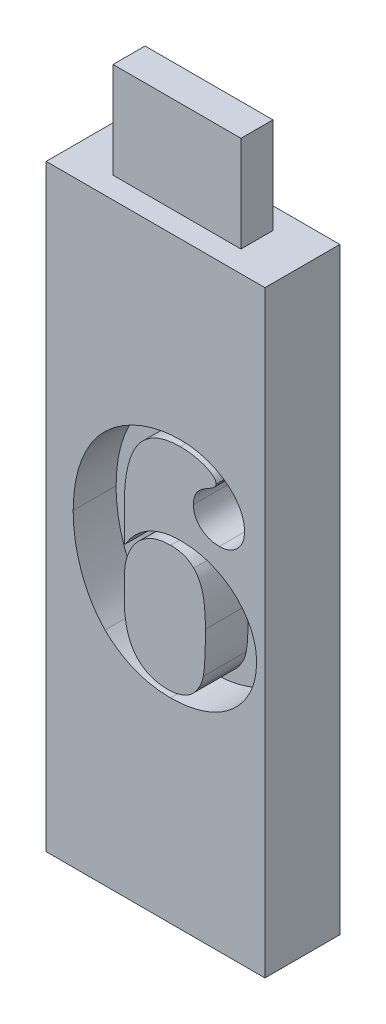
from build123d import *

# Parameters (mm, degrees)
SKETCH1_W           = 17.38
SKETCH1_H           = 47.498
BOSS_EXTRUDE1_DEPTH = 5.95
CUT_EXTRUDE1_DEPTH  = 3.41
SKETCH3_W           = 10.16
SKETCH3_H           = 2.54
BOSS_EXTRUDE2_DEPTH = 7.62


with BuildPart() as part:
    # Sketch1 → Boss-Extrude1 (new body)
    with BuildSketch(Plane.XY):
        Rectangle(SKETCH1_W, SKETCH1_H)
    extrude(amount=BOSS_EXTRUDE1_DEPTH)

    # Sketch2 → Cut-Extrude1 (cut)
    with BuildSketch(Plane.XY.offset(5.95)):
        with BuildLine():
            Line((-2.483570852, 3.233513783), (-2.483570852, 0.531761662))
            Line((-2.483570852, 0.531761662), (-2.431327027, 0.531761662))
            add(Edge.make_bspline(
                [(-2.431327027, 0.531761662), (-2.301633443, 0.728004463), (-2.04890766, 1.110410549), (-1.59841556, 1.61627183), (-1.104273504, 2.044303347), (-0.565213823, 2.396543519), (0.020062663, 2.666484477), (0.647167649, 2.860520396), (1.319499928, 2.979575642), (1.782504398, 2.992018255), (2.020593251, 2.998416568)],
                knots=[0, 0, 0, 0, 1.056220461, 2.058190816, 3.033330861, 3.987046614, 4.942579704, 5.920488651, 6.930661574, 8, 8, 8, 8], degree=3))
            add(Edge.make_bspline(
                [(2.020593251, 2.998416568), (2.291024879, 2.989726752), (2.822688252, 2.972642741), (3.603097789, 2.839948645), (4.346430935, 2.61354988), (5.049160763, 2.305239746), (5.70119483, 1.921473283), (6.285965544, 1.464848311), (6.799589537, 0.940462699), (7.234824577, 0.355514148), (7.587839118, -0.277068181), (7.838772014, -0.950147499), (7.999881544, -1.653634968), (8.016504347, -2.135531766), (8.024901487, -2.378965762)],
                knots=[0, 0, 0, 0, 1.085565472, 2.134200812, 3.167617413, 4.198689485, 5.20867526, 6.197881964, 7.169234309, 8.147254864, 9.117566385, 10.067570574, 11.023817926, 12, 12, 12, 12], degree=3))
            add(Edge.make_bspline(
                [(8.024901487, -2.378965762), (8.021696861, -2.513392762), (8.01533223, -2.780375001), (7.974678924, -3.176124846), (7.902094334, -3.56223173), (7.806223843, -3.940876557), (7.678303321, -4.309483663), (7.525248707, -4.670692294), (7.340555615, -5.020996539), (7.133591771, -5.364218641), (6.897907386, -5.690377589), (6.644318497, -6.002506927), (6.366887623, -6.292467788), (6.071535257, -6.568600946), (5.748554094, -6.819327185), (5.41051496, -7.06112093), (5.046666519, -7.275695629), (4.537288266, -7.540917281), (3.863752304, -7.819178984), (3.008909006, -8.053317379), (2.112657358, -8.199141153), (1.499959436, -8.217306216), (1.188423744, -8.226542522)],
                knots=[0, 0, 0, 0, 0.804288942, 1.59737897, 2.376839251, 3.152988498, 3.931986793, 4.708849282, 5.497738221, 6.299268016, 7.104692352, 7.903210753, 8.703357407, 9.50385007, 10.319761299, 11.147700359, 11.988780022, 12.844223646, 14.582806956, 16.3359984, 18.136981967, 20, 20, 20, 20], degree=3))
            add(Edge.make_bspline(
                [(1.188423744, -8.226542522), (0.933120462, -8.219963195), (0.430587576, -8.207012606), (-0.306955805, -8.108572416), (-1.01240185, -7.945190052), (-1.683445678, -7.712294765), (-2.320522841, -7.416084718), (-2.923453171, -7.059116449), (-3.495421502, -6.646350498), (-3.840157488, -6.324706605), (-4.0135686, -6.162911413)],
                knots=[0, 0, 0, 0, 1.066279502, 2.098839125, 3.102153465, 4.086517057, 5.060622849, 6.032022188, 7.010056287, 8, 8, 8, 8], degree=3))
            add(Edge.make_bspline(
                [(-4.0135686, -6.162911413), (-4.144115002, -6.023187792), (-4.406717191, -5.74212506), (-4.759576912, -5.278557214), (-5.090362905, -4.785509921), (-5.387843956, -4.256131974), (-5.650175286, -3.695741555), (-5.887990361, -3.114311813), (-6.083740456, -2.505717976), (-6.252881159, -1.877450318), (-6.382639032, -1.227876364), (-6.475225118, -0.563754728), (-6.533102612, 0.112780916), (-6.540126826, 0.567720377), (-6.543662438, 0.796712491)],
                knots=[0, 0, 0, 0, 0.906810192, 1.82410497, 2.760456108, 3.722425217, 4.701924771, 5.694917275, 6.700944844, 7.733173074, 8.780727414, 9.841631564, 10.913593138, 12, 12, 12, 12], degree=3))
            add(Edge.make_bspline(
                [(-6.543662438, 0.796712491), (-6.535275919, 1.125414253), (-6.51873622, 1.773672285), (-6.402858902, 2.72716023), (-6.204095817, 3.642456725), (-5.928580775, 4.517650427), (-5.575835213, 5.346550679), (-5.143134486, 6.120612191), (-4.637372255, 6.841209129), (-4.236609892, 7.26700551), (-4.035958811, 7.48019046)],
                knots=[0, 0, 0, 0, 1.076732046, 2.123506097, 3.140990736, 4.14108443, 5.125083853, 6.086480381, 7.041951503, 8, 8, 8, 8], degree=3))
            add(Edge.make_bspline(
                [(-4.035958811, 7.48019046), (-3.835748195, 7.667523696), (-3.436434164, 8.041154179), (-2.767828463, 8.522710055), (-2.05279501, 8.94162773), (-1.29378104, 9.295899885), (-0.501963955, 9.573561744), (0.305869221, 9.776417565), (1.126138704, 9.900161498), (1.676858248, 9.916333687), (1.953422618, 9.924455156)],
                knots=[0, 0, 0, 0, 0.991626942, 1.977770001, 2.974698163, 3.98792387, 5.004674858, 6.007149241, 6.999215628, 8, 8, 8, 8], degree=3))
            add(Edge.make_bspline(
                [(1.953422618, 9.924455156), (2.183928864, 9.919629706), (2.637132028, 9.910142288), (3.299318367, 9.808425453), (3.931494772, 9.6533518), (4.527218995, 9.433851095), (5.077965419, 9.157930959), (5.578927779, 8.838848945), (6.016887161, 8.465425006), (6.387526638, 8.048566407), (6.694626795, 7.60421693), (6.908945915, 7.128685255), (7.048312481, 6.634790896), (7.062479966, 6.295671606), (7.06958582, 6.125582698)],
                knots=[0, 0, 0, 0, 1.176649862, 2.313435961, 3.413818245, 4.497431994, 5.548876995, 6.555291509, 7.524342622, 8.478423796, 9.398398398, 10.271373412, 11.13298884, 12, 12, 12, 12], degree=3))
            add(Edge.make_bspline(
                [(7.06958582, 6.125582698), (7.062188115, 5.990579374), (7.047773194, 5.727516379), (6.941262996, 5.348674262), (6.756334698, 5.006110153), (6.507079144, 4.703417598), (6.207615632, 4.447236369), (5.859121624, 4.265556519), (5.474309802, 4.153134154), (5.204522895, 4.139745265), (5.06566194, 4.132853923)],
                knots=[0, 0, 0, 0, 1.027576524, 2.002301507, 2.968656818, 3.971880041, 4.973849907, 5.948574889, 6.944119068, 8, 8, 8, 8], degree=3))
            add(Edge.make_bspline(
                [(5.06566194, 4.132853923), (4.923323523, 4.139234686), (4.647551299, 4.151597034), (4.25252073, 4.249090015), (3.898368889, 4.418449961), (3.585134131, 4.642976941), (3.329386506, 4.924231155), (3.143302279, 5.245957201), (3.029692733, 5.604455285), (3.016361281, 5.854816619), (3.009494234, 5.983778028)],
                knots=[0, 0, 0, 0, 1.104207416, 2.13933625, 3.132777133, 4.135187476, 5.112733794, 6.060103572, 7.000757133, 8, 8, 8, 8], degree=3))
            add(Edge.make_bspline(
                [(3.009494234, 5.983778028), (3.013272345, 6.077292988), (3.020638559, 6.259619932), (3.072042932, 6.522116964), (3.162688183, 6.762019191), (3.293249682, 6.980172754), (3.465259308, 7.179814195), (3.67844772, 7.367427599), (3.933021338, 7.547641504), (4.125228796, 7.65027042), (4.226029029, 7.70409257)],
                knots=[0, 0, 0, 0, 1.002282866, 1.954159775, 2.853104578, 3.738095954, 4.665180635, 5.666220965, 6.776085621, 8, 8, 8, 8], degree=3))
            add(Edge.make_bspline(
                [(4.226029029, 7.70409257), (4.313703055, 7.753912914), (4.470030942, 7.842745485), (4.654043501, 7.991231783), (4.782736337, 8.131344093), (4.802953487, 8.236112099), (4.811906216, 8.282506353)],
                knots=[0, 0, 0, 0, 1.414637955, 2.522381745, 3.345668607, 4, 4, 4, 4], degree=3))
            add(Edge.make_bspline(
                [(4.811906216, 8.282506353), (4.806034743, 8.33178002), (4.793867688, 8.433886492), (4.71492537, 8.583499107), (4.584819723, 8.722048409), (4.410784005, 8.855566555), (4.198282154, 8.980229958), (3.952304862, 9.095459614), (3.673123898, 9.195379419), (3.255420633, 9.315316351), (2.684028189, 9.426631519), (2.211534364, 9.439945058), (1.968349425, 9.446797322)],
                knots=[0, 0, 0, 0, 0.452605788, 0.937904211, 1.520351934, 2.187580741, 2.945709957, 3.778630565, 4.678420582, 5.665347929, 7.769024611, 10, 10, 10, 10], degree=3))
            add(Edge.make_bspline(
                [(1.968349425, 9.446797322), (1.786435892, 9.443515204), (1.433390579, 9.437145495), (0.92231927, 9.358768746), (0.446763809, 9.240969968), (0.004538454, 9.078156127), (-0.398223568, 8.858241502), (-0.765794725, 8.592452157), (-1.09775722, 8.278497372), (-1.394301464, 7.917957967), (-1.653062397, 7.505894042), (-1.875455964, 7.044544236), (-2.067319113, 6.534213848), (-2.216492225, 5.970784148), (-2.340719281, 5.359358235), (-2.424917124, 4.695855247), (-2.471725736, 3.981783306), (-2.479533091, 3.488583759), (-2.483570852, 3.233513783)],
                knots=[0, 0, 0, 0, 1.000646965, 1.941987028, 2.838861465, 3.694857228, 4.528314065, 5.357031146, 6.185408634, 7.036790128, 7.920204297, 8.857375418, 9.852029235, 10.916904478, 12.062481405, 13.284761828, 14.595749452, 16, 16, 16, 16], degree=3))
        make_face()
        with BuildLine():
            Line((-2.483570852, -1.766966663), (-2.483570852, -3.352939938))
            add(Edge.make_bspline(
                [(-2.483570852, -3.352939938), (-2.478294055, -3.583235329), (-2.468169932, -4.025082658), (-2.398742895, -4.661288378), (-2.277199518, -5.240466476), (-2.106872347, -5.763629768), (-1.886688313, -6.227928991), (-1.616303587, -6.63281644), (-1.295598857, -6.977900368), (-0.925057451, -7.259801508), (-0.512633341, -7.482959451), (-0.05712944, -7.632334353), (0.432464984, -7.735831356), (0.773624606, -7.744442868), (0.949594827, -7.748884688)],
                knots=[0, 0, 0, 0, 1.307711257, 2.508989542, 3.628394977, 4.662611495, 5.626224499, 6.537216912, 7.416805033, 8.288501246, 9.170214014, 10.065962313, 11.002422865, 12, 12, 12, 12], degree=3))
            add(Edge.make_bspline(
                [(0.949594827, -7.748884688), (1.085389518, -7.745718153), (1.349676908, -7.739555356), (1.731016504, -7.680070008), (2.082583192, -7.577706714), (2.404844668, -7.440999436), (2.697563784, -7.263608953), (2.957037625, -7.04281913), (3.191411189, -6.786260546), (3.315902483, -6.587966307), (3.378932715, -6.487569471)],
                knots=[0, 0, 0, 0, 1.132088417, 2.203301851, 3.208039144, 4.179383829, 5.115341592, 6.050551486, 7.012989671, 8, 8, 8, 8], degree=3))
            add(Edge.make_bspline(
                [(3.378932715, -6.487569471), (3.423971216, -6.416280283), (3.517489227, -6.268255305), (3.632723061, -6.020790539), (3.725351561, -5.74084667), (3.772321565, -5.542619209), (3.796883319, -5.438961258)],
                knots=[0, 0, 0, 0, 0.890219004, 1.848452091, 2.874903381, 4, 4, 4, 4], degree=3))
            add(Edge.make_bspline(
                [(3.796883319, -5.438961258), (3.811396486, -5.355743484), (3.842905349, -5.175073233), (3.875047614, -4.878476534), (3.89850045, -4.534713251), (3.926953794, -4.143135273), (3.944379232, -3.702603663), (3.954390202, -3.21490459), (3.96214537, -2.68001183), (3.96389637, -2.3080663), (3.964809902, -2.114014932)],
                knots=[0, 0, 0, 0, 0.608215762, 1.320469035, 2.14697982, 3.089649346, 4.147632482, 5.321427754, 6.602535677, 8, 8, 8, 8], degree=3))
            add(Edge.make_bspline(
                [(3.964809902, -2.114014932), (3.963775648, -1.877579641), (3.961825052, -1.431664236), (3.918484721, -0.804279409), (3.860380358, -0.256120356), (3.766536905, 0.218346366), (3.643965053, 0.635061338), (3.481260375, 1.004014481), (3.28644276, 1.339015144), (3.118506736, 1.528092818), (3.035616147, 1.621418595)],
                knots=[0, 0, 0, 0, 1.43875232, 2.713477419, 3.826375623, 4.791548233, 5.653828196, 6.464113452, 7.241910473, 8, 8, 8, 8], degree=3))
            add(Edge.make_bspline(
                [(3.035616147, 1.621418595), (2.920182999, 1.722854506), (2.686455845, 1.928240284), (2.248298089, 2.138762676), (1.744956743, 2.261030495), (1.386949008, 2.274750648), (1.199618849, 2.281929818)],
                knots=[0, 0, 0, 0, 0.917341977, 1.857419058, 2.878878896, 4, 4, 4, 4], degree=3))
            add(Edge.make_bspline(
                [(1.199618849, 2.281929818), (1.022585207, 2.275166901), (0.677172335, 2.261971677), (0.174026354, 2.167773044), (-0.295989602, 2.006479487), (-0.730257136, 1.781466868), (-1.124912734, 1.500022964), (-1.47510898, 1.164159042), (-1.780108926, 0.776614758), (-2.031348995, 0.339183317), (-2.234787895, -0.137690992), (-2.379270746, -0.650476884), (-2.466810376, -1.197999616), (-2.477881467, -1.573829379), (-2.483570852, -1.766966663)],
                knots=[0, 0, 0, 0, 1.036692509, 2.022705586, 2.985840741, 3.937386468, 4.877538716, 5.81542962, 6.770150053, 7.75613621, 8.761635014, 9.799479048, 10.869161839, 12, 12, 12, 12], degree=3))
        make_face(mode=Mode.SUBTRACT)
    extrude(amount=-CUT_EXTRUDE1_DEPTH, mode=Mode.SUBTRACT)

    # Sketch3 → Boss-Extrude2 (add)
    with BuildSketch(Plane(origin=(0, 23.749, 0), x_dir=(1, 0, 0), z_dir=(0, 1, 0))):
        with Locations((0, -2.975)):
            Rectangle(SKETCH3_W, SKETCH3_H)
    extrude(amount=BOSS_EXTRUDE2_DEPTH)


solid = part.part
